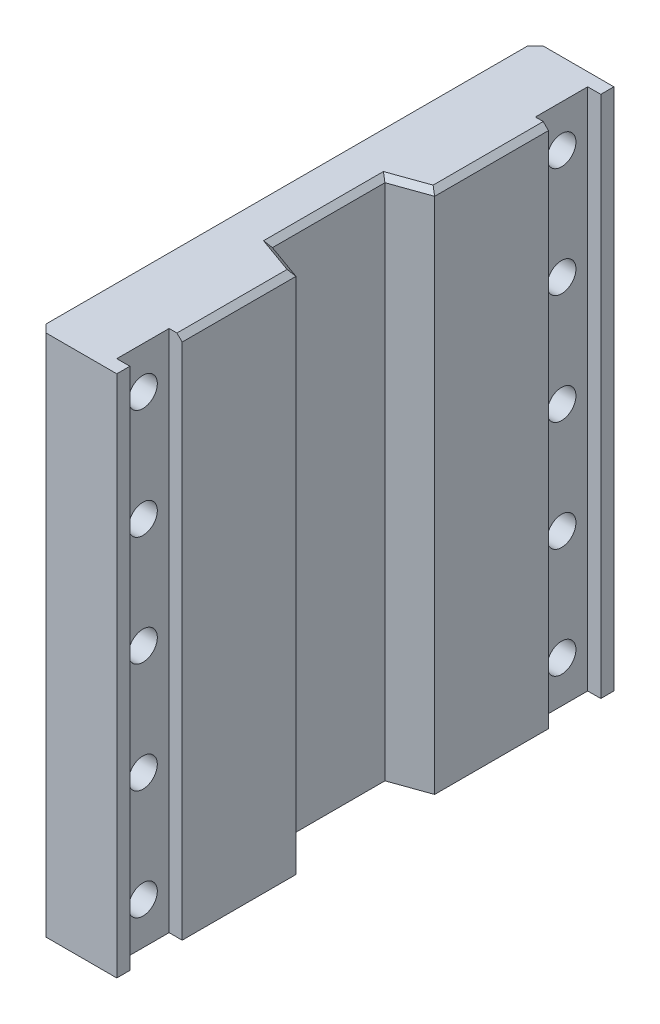
from build123d import *

# Parameters (mm, degrees)
ESTRUSIONE1_DEPTH                                    = 200
M10_LAMATURA_PER_VITE_A_COPERTURA_CILIND_D           = 11
M10_LAMATURA_PER_VITE_A_COPERTURA_CILIND_CBORE_D     = 18
M10_LAMATURA_PER_VITE_A_COPERTURA_CILIND_CBORE_DEPTH = 10
RIPETIZIONE_A_L1_COUNT                               = 5
RIPETIZIONE_A_L1_PITCH                               = 42
RIPETIZIONE_A_L1_COUNT_DIR2                          = 2
RIPETIZIONE_A_L1_PITCH_DIR2                          = 160
SMUSSO1_SIZE                                         = 3
SMUSSO2_SIZE                                         = 2


with BuildPart() as part:
    # Schizzo1 → Estrusione1 (new body)
    with BuildSketch(Plane(origin=(0, 0, 0), x_dir=(1, 0, 0), z_dir=(0, 1, 0))):
        Polygon((0, -95), (0, 95), (30, 95), (30, 90), (25, 90), (25, 70), (30, 70), (30, 66), (30, 26.5), (16, 21.5), (16, -21.5), (30, -26.5), (30, -66), (30, -70), (25, -70), (25, -90), (30, -90), (30, -95), align=None)
    extrude(amount=ESTRUSIONE1_DEPTH)

    # M10 Lamatura per vite a copertura cilindrica esagonale1 (through all)
    with Locations(Plane.ZY):
        with Locations((80, 184)):
            m10_lamatura_per_vite_a_copertura_cilind = CounterBoreHole(M10_LAMATURA_PER_VITE_A_COPERTURA_CILIND_D / 2, M10_LAMATURA_PER_VITE_A_COPERTURA_CILIND_CBORE_D / 2, M10_LAMATURA_PER_VITE_A_COPERTURA_CILIND_CBORE_DEPTH)

    # Ripetizione a L1: M10 Lamatura per vite a copertura cilind 5 × 2
    with Locations(*[(0, -i * RIPETIZIONE_A_L1_PITCH, -j * RIPETIZIONE_A_L1_PITCH_DIR2) for i in range(RIPETIZIONE_A_L1_COUNT) for j in range(RIPETIZIONE_A_L1_COUNT_DIR2) if (i, j) != (0, 0)]):
        add(m10_lamatura_per_vite_a_copertura_cilind, mode=Mode.SUBTRACT)

    # Smusso1
    smusso1_edges = [part.edges().sort_by_distance(p)[0] for p in [
        (0, 100, 95),
        (0, 100, -95),
    ]]
    chamfer(smusso1_edges, length=SMUSSO1_SIZE)

    # Smusso2
    smusso2_edges = [part.edges().sort_by_distance(p)[0] for p in [
        (30, 200, 48.25),
        (23, 200, 24),
        (16, 200, 0),
        (23, 200, -24),
        (30, 200, -48.25),
    ]]
    chamfer(smusso2_edges, length=SMUSSO2_SIZE)


solid = part.part
